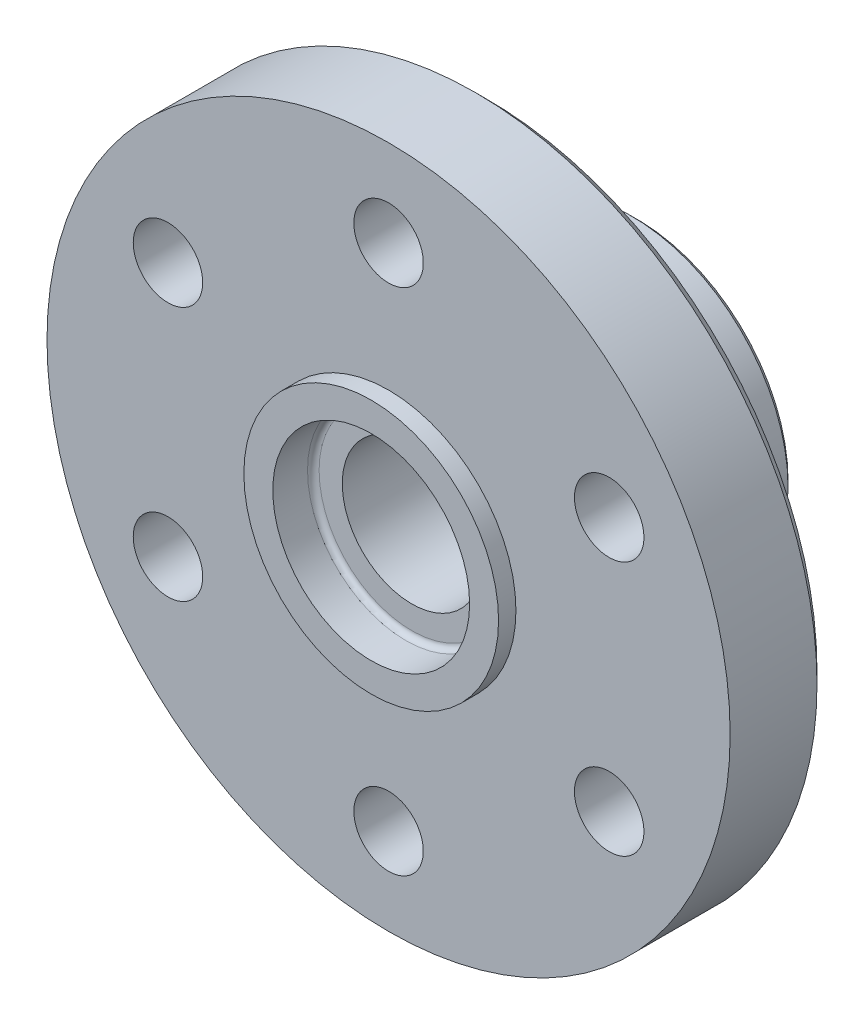
from build123d import *

# Parameters (mm, degrees)
CUT_EXTRUDE1_REACH = 89.396
SKETCH2_R          = 6
CIRPATTERN1_COUNT  = 6
FILLET1_R          = 2
FILLET2_R          = 1
CHAMFER1_SIZE      = 1
CHAMFER2_SIZE      = 2


with BuildPart() as part:
    # Sketch1 → Revolve1 (revolve)
    with BuildSketch(Plane(origin=(0, 0, 0), x_dir=(0, 0, -1), z_dir=(1, 0, 0)), mode=Mode.PRIVATE) as revolve1_sk:
        Polygon((-11.208917924, 22), (-11.208917924, 59), (5.791082076, 59), (5.791082076, 27), (31.791082076, 27), (31.791082076, 12), (-7.208917924, 12), (-7.208917924, 17), (-14.208917924, 17), (-14.208917924, 22), align=None)
    revolve(revolve1_sk.sketch.rotate(Axis((0, 0, 9.001223373), (0, 0, -1)), 90), axis=Axis((0, 0, 9.001223373), (0, 0, -1)))

    # Sketch2 → Cut-Extrude1 (cut, up to next)
    with BuildSketch(Plane(origin=(0, 0, -5.791082076), x_dir=(-1, 0, 0), z_dir=(0, 0, -1)), mode=Mode.PRIVATE) as cut_extrude1_sk1:
        with Locations((0, 44)):
            Circle(SKETCH2_R)
    cut_extrude1_tool1 = extrude(cut_extrude1_sk1.sketch, amount=-CUT_EXTRUDE1_REACH, mode=Mode.PRIVATE) & part.part
    cut_extrude1 = cut_extrude1_tool1.solids().sort_by_distance((0, 44, -5.791082))[0]
    add(cut_extrude1, mode=Mode.SUBTRACT)

    # CirPattern1: Cut-Extrude1 ×6 about axis
    cirpattern1_axis = Axis((0, 0, 0), (0, 0, 1))
    for i in range(1, CIRPATTERN1_COUNT):
        add(cut_extrude1.rotate(cirpattern1_axis, i * 360 / CIRPATTERN1_COUNT), mode=Mode.SUBTRACT)

    # Fillet1
    fillet1_edges = [part.edges().sort_by_distance(p)[0] for p in [
        (-27, 0, -5.791082076),
    ]]
    fillet(fillet1_edges, radius=FILLET1_R)

    # Fillet2
    fillet2_edges = [part.edges().sort_by_distance(p)[0] for p in [
        (-17, 0, 7.208917924),
    ]]
    fillet(fillet2_edges, radius=FILLET2_R)

    # Chamfer1
    chamfer1_edges = [part.edges().sort_by_distance(p)[0] for p in [
        (-12, 0, -31.791082076),
        (-27, 0, -31.791082076),
    ]]
    chamfer(chamfer1_edges, length=CHAMFER1_SIZE)

    # Chamfer2
    chamfer2_edges = [part.edges().sort_by_distance(p)[0] for p in [
        (-59, 0, -5.791082076),
    ]]
    chamfer(chamfer2_edges, length=CHAMFER2_SIZE)


solid = part.part
